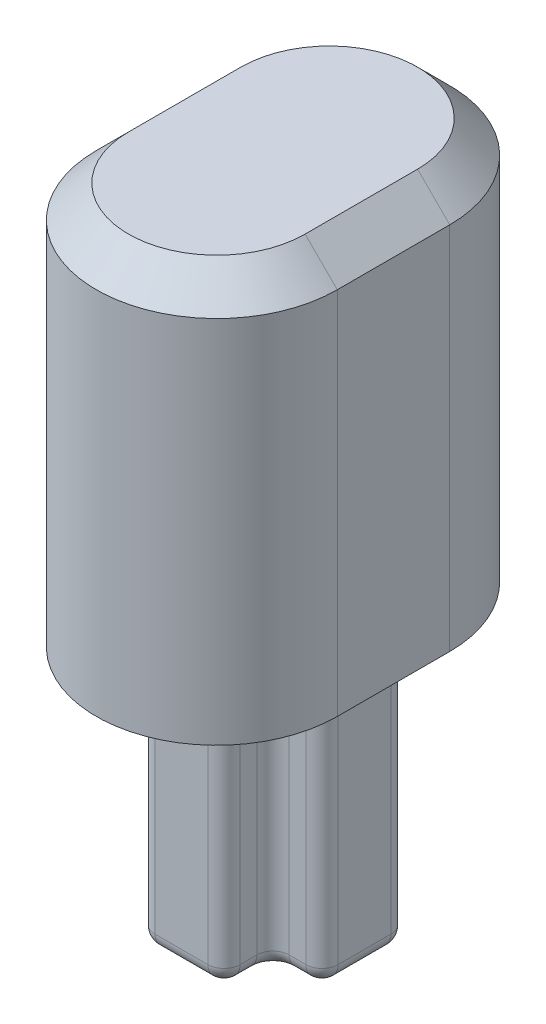
from build123d import *

# Parameters (mm, degrees)
BOSS_EXTRUDE1_DEPTH = 8.1
BOSS_EXTRUDE2_DEPTH = 12.5
FILLET1_R           = 0.5
FILLET2_R           = 0.5
FILLET4_R           = 0.5
CHAMFER2_SIZE       = 1


with BuildPart() as part:
    # Sketch8 → Boss-Extrude1 (new body)
    with BuildSketch(Plane(origin=(-2.232753674, 0, 0.665681661), x_dir=(-1, 0, 0), z_dir=(0, -1, 0))):
        Polygon((-24.744344877, -18.877779499), (-23.219344877, -18.877779499), (-23.219344877, -21.527779499), (-24.744344877, -21.527779499), (-24.744344877, -23.052779499), (-27.394344877, -23.052779499), (-27.394344877, -21.527779499), (-28.919344877, -21.527779499), (-28.919344877, -18.877779499), (-27.394344877, -18.877779499), (-27.394344877, -17.352779499), (-24.744344877, -17.352779499), align=None)
        Polygon((-26.694344877, -20.827779499), (-26.694344877, -22.352779499), (-25.444344877, -22.352779499), (-25.444344877, -20.827779499), (-23.919344877, -20.827779499), (-23.919344877, -19.577779499), (-25.444344877, -19.577779499), (-25.444344877, -18.052779499), (-26.694344877, -18.052779499), (-26.694344877, -19.577779499), (-28.219344877, -19.577779499), (-28.219344877, -20.827779499), align=None, mode=Mode.SUBTRACT)
    extrude(amount=BOSS_EXTRUDE1_DEPTH)

    # Sketch9 → Boss-Extrude2 (add)
    with BuildSketch(Plane(origin=(0, 0, 0), x_dir=(-1, 0, 0), z_dir=(0, 1, 0))):
        with BuildLine():
            Line((-20.086591203, 22.61846116), (-20.086591203, 19.11846116))
            ThreePointArc((-20.086591203, 19.11846116), (-23.836591203, 15.36846116), (-27.586591203, 19.11846116))
            Line((-27.586591203, 19.11846116), (-27.586591203, 22.61846116))
            ThreePointArc((-27.586591203, 22.61846116), (-23.836591203, 26.36846116), (-20.086591203, 22.61846116))
        make_face()
    extrude(amount=BOSS_EXTRUDE2_DEPTH)

    # Fillet1
    fillet1_edges = [part.edges().sort_by_distance(p)[0] for p in [
        (22.511591203, -4.05, 19.54346116),
        (20.986591203, -4.05, 19.54346116),
        (20.986591203, -4.05, 22.19346116),
        (22.511591203, -4.05, 22.19346116),
        (22.511591203, -4.05, 23.71846116),
        (25.161591203, -4.05, 23.71846116),
        (25.161591203, -4.05, 22.19346116),
        (26.686591203, -4.05, 22.19346116),
        (26.686591203, -4.05, 19.54346116),
        (25.161591203, -4.05, 19.54346116),
        (25.161591203, -4.05, 18.01846116),
        (22.511591203, -4.05, 18.01846116),
    ]]
    fillet(fillet1_edges, radius=FILLET1_R)

    # Fillet2
    fillet2_edges = [part.edges().sort_by_distance(p)[0] for p in [
        (21.749091203, 0, 19.54346116),
        (20.986591203, 0, 20.86846116),
        (21.749091203, 0, 22.19346116),
        (22.511591203, 0, 22.95596116),
        (23.836591203, 0, 23.71846116),
        (25.161591203, 0, 22.95596116),
        (25.924091203, 0, 22.19346116),
        (26.686591203, 0, 20.86846116),
        (25.924091203, 0, 19.54346116),
        (25.161591203, 0, 18.78096116),
        (23.836591203, 0, 18.01846116),
        (25.308037813, 0, 19.39701455),
        (25.308037813, 0, 22.339907769),
        (22.365144594, 0, 22.339907769),
        (22.365144594, 0, 19.39701455),
        (21.133037813, 0, 19.689907769),
        (21.133037813, 0, 22.04701455),
        (22.658037813, 0, 23.57201455),
        (25.015144594, 0, 23.57201455),
        (26.540144594, 0, 22.04701455),
        (26.540144594, 0, 19.689907769),
        (22.658037813, 0, 18.164907769),
        (25.015144594, 0, 18.164907769),
        (22.511591203, 0, 18.78096116),
    ]]
    fillet(fillet2_edges, radius=FILLET2_R)

    # Fillet4
    fillet4_edges = [part.edges().sort_by_distance(p)[0] for p in [
        (21.749091203, -8.1, 19.54346116),
        (20.986591203, -8.1, 20.86846116),
        (23.836591203, -8.1, 18.01846116),
        (25.161591203, -8.1, 18.78096116),
        (25.924091203, -8.1, 19.54346116),
        (26.686591203, -8.1, 20.86846116),
        (25.924091203, -8.1, 22.19346116),
        (25.161591203, -8.1, 22.95596116),
        (23.836591203, -8.1, 23.71846116),
        (22.511591203, -8.1, 22.95596116),
        (21.749091203, -8.1, 22.19346116),
        (25.015144594, -8.1, 18.164907769),
        (22.658037813, -8.1, 18.164907769),
        (26.540144594, -8.1, 19.689907769),
        (26.540144594, -8.1, 22.04701455),
        (25.015144594, -8.1, 23.57201455),
        (22.658037813, -8.1, 23.57201455),
        (21.133037813, -8.1, 22.04701455),
        (21.133037813, -8.1, 19.689907769),
        (22.365144594, -8.1, 19.39701455),
        (22.365144594, -8.1, 22.339907769),
        (25.308037813, -8.1, 22.339907769),
        (25.308037813, -8.1, 19.39701455),
        (22.511591203, -8.1, 18.78096116),
    ]]
    fillet(fillet4_edges, radius=FILLET4_R)

    # Chamfer2
    chamfer2_edges = [part.edges().sort_by_distance(p)[0] for p in [
        (23.836591203, 12.5, 26.36846116),
        (27.586591203, 12.5, 20.86846116),
        (23.836591203, 12.5, 15.36846116),
        (20.086591203, 12.5, 20.86846116),
    ]]
    chamfer(chamfer2_edges, length=CHAMFER2_SIZE)


solid = part.part
